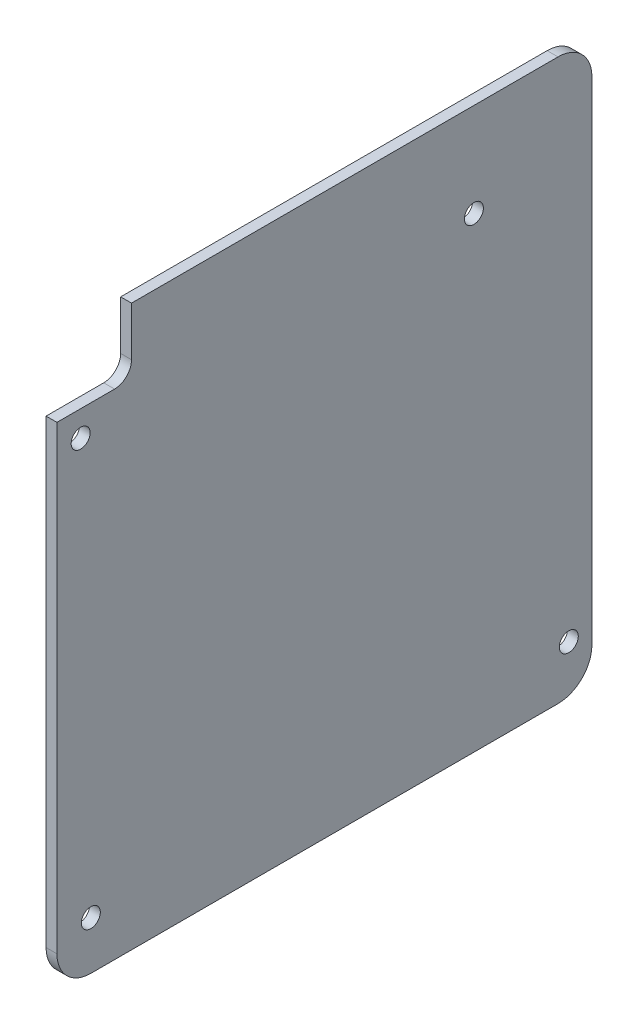
from build123d import *

# Parameters (mm, degrees)
SKETCH1_R           = 1.4
BOSS_EXTRUDE1_DEPTH = 0.8


with BuildPart() as part:
    # Sketch1 → Boss-Extrude1 (new, symmetric)
    with BuildSketch(Plane(origin=(0, 0, 0), x_dir=(0, 0, -1), z_dir=(1, 0, 0))):
        with BuildLine():
            Line((-34.468542217, -41.323283133), (34.440131171, -41.323283133))
            ThreePointArc((34.440131171, -41.323283133), (37.975665077, -39.858817038), (39.440131171, -36.323283133))
            Line((39.440131171, -36.323283133), (39.440131171, 36.293536969))
            ThreePointArc((39.440131171, 36.293536969), (37.975665077, 39.829070875), (34.440131171, 41.293536969))
            Line((34.440131171, 41.293536969), (-28.468542217, 41.293536969))
            Line((-28.468542217, 41.293536969), (-28.468542217, 34.063536969))
            ThreePointArc((-28.468542217, 34.063536969), (-29.200775264, 32.295770016), (-30.968542217, 31.563536969))
            Line((-30.968542217, 31.563536969), (-39.468542217, 31.563536969))
            Line((-39.468542217, 31.563536969), (-39.468542217, -36.323283133))
            ThreePointArc((-39.468542217, -36.323283133), (-38.004076123, -39.858817038), (-34.468542217, -41.323283133))
        make_face()
        with Locations((-35.968542217, 27.793536969)):
            Circle(SKETCH1_R, mode=Mode.SUBTRACT)
        with Locations((22.031457783, 27.493536969)):
            Circle(SKETCH1_R, mode=Mode.SUBTRACT)
        with Locations((-34.468542217, -34.206463031)):
            Circle(SKETCH1_R, mode=Mode.SUBTRACT)
        with Locations((36.031457783, -34.206463031)):
            Circle(SKETCH1_R, mode=Mode.SUBTRACT)
    extrude(amount=BOSS_EXTRUDE1_DEPTH, both=True)


solid = part.part
